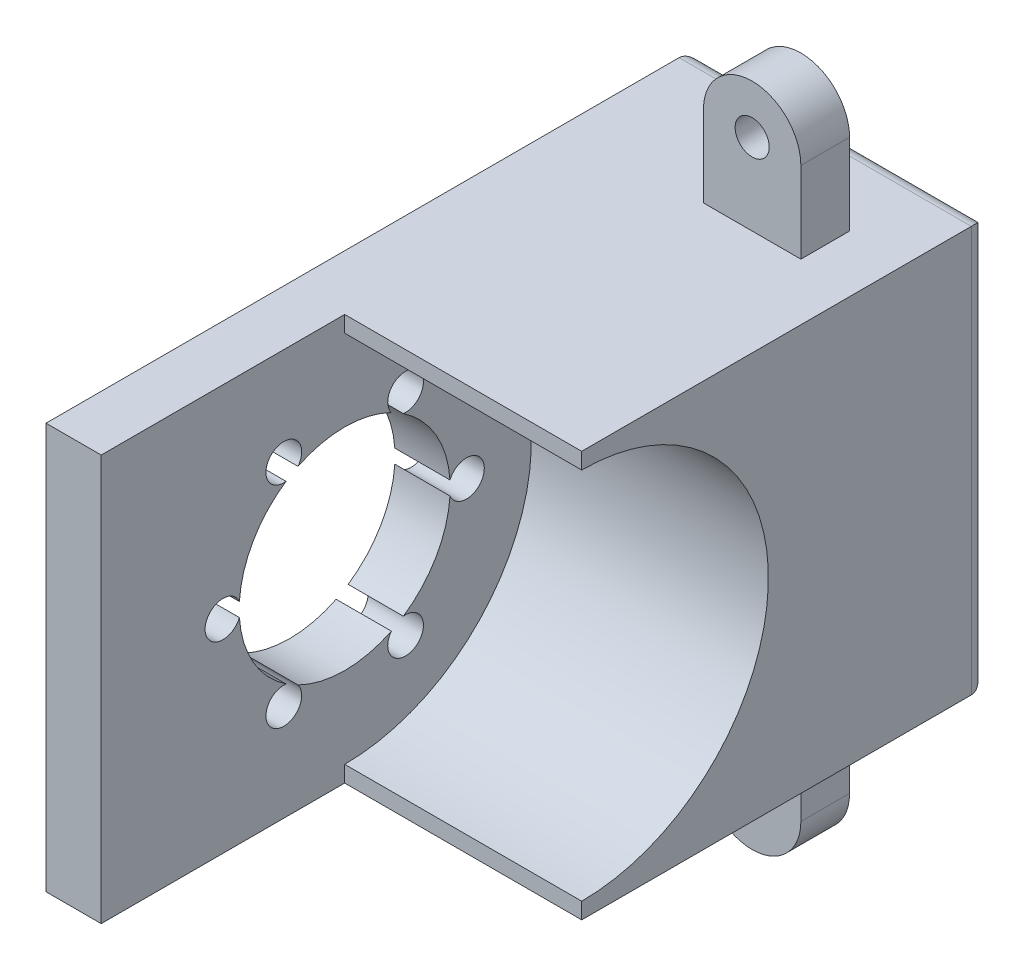
from build123d import *

# Parameters (mm, degrees)
SKETCH_1_W          = 23
SKETCH_1_H          = 25
EXTRUDE_1_DEPTH     = 25
SKETCH_2_W          = 19.6
SKETCH_2_H          = 11.5
SKETCH_4_W          = 3.4
SKETCH_4_H          = 25
EXTRUDE_2_DEPTH     = 15
CUT_EXTRUDE_1_DEPTH = 4
SKETCH_8_R          = 1.05
EXTRUDE_3_DEPTH     = 8
SKETCH_8_2_R        = 1.05
CUT_EXTRUDE_4_DEPTH = 5
SKETCH_7_W          = 35
SKETCH_7_H          = 40
CUT_EXTRUDE_3_DEPTH = 5
FILLET_1_R          = 1


with BuildPart() as part:
    # 草图1 → 凸台-拉伸1 (new body)
    with BuildSketch(Plane.XY):
        Rectangle(SKETCH_1_W, SKETCH_1_H)
    extrude(amount=-EXTRUDE_1_DEPTH)

    # 草图2 → 切除-旋转2 (revolve, cut)
    with BuildSketch(Plane.XY):
        with Locations((1.7, -5.75)):
            Rectangle(SKETCH_2_W, SKETCH_2_H)
    revolve(axis=Axis((11.5, 0, 0), (-1, 0, 0)), mode=Mode.SUBTRACT)

    # 草图4 → 凸台-拉伸2 (add)
    with BuildSketch(Plane.XY):
        with Locations((-9.8, 0)):
            Rectangle(SKETCH_4_W, SKETCH_4_H)
    extrude(amount=EXTRUDE_2_DEPTH)

    # 草图6 → 切除-拉伸1 (cut)
    with BuildSketch(Plane(origin=(-8.1, 0, 0), x_dir=(0, 0, -1), z_dir=(1, 0, 0))):
        with BuildLine():
            ThreePointArc((6.486, -0.426384803), (8.6, 0), (6.486, 0.426384803))
            ThreePointArc((6.486, 0.426384803), (5.629165125, 3.25), (3.612260071, 5.403848368))
            ThreePointArc((3.612260071, 5.403848368), (4.3, 7.447818473), (2.873739929, 5.83023317))
            ThreePointArc((2.873739929, 5.83023317), (0, 6.5), (-2.873739929, 5.83023317))
            ThreePointArc((-2.873739929, 5.83023317), (-4.3, 7.447818473), (-3.612260071, 5.403848368))
            ThreePointArc((-3.612260071, 5.403848368), (-5.629165125, 3.25), (-6.486, 0.426384803))
            ThreePointArc((-6.486, 0.426384803), (-8.6, 0), (-6.486, -0.426384803))
            ThreePointArc((-6.486, -0.426384803), (-5.629165125, -3.25), (-3.612260071, -5.403848368))
            ThreePointArc((-3.612260071, -5.403848368), (-4.3, -7.447818473), (-2.873739929, -5.83023317))
            ThreePointArc((-2.873739929, -5.83023317), (0, -6.5), (2.873739929, -5.83023317))
            ThreePointArc((2.873739929, -5.83023317), (4.3, -7.447818473), (3.612260071, -5.403848368))
            ThreePointArc((3.612260071, -5.403848368), (5.629165125, -3.25), (6.486, -0.426384803))
        make_face()
    extrude(amount=-CUT_EXTRUDE_1_DEPTH, mode=Mode.SUBTRACT)

    # 草图8 → 凸台-拉伸3 (add)
    # profile 1 of 2: a face of its own
    with BuildSketch(Plane(origin=(0, 0, -25), x_dir=(-1, 0, 0), z_dir=(0, 0, -1))):
        with BuildLine():
            Line((3, 17.5), (3, 12.5))
            Line((3, 12.5), (-3, 12.5))
            Line((-3, 12.5), (-3, 17.5))
            ThreePointArc((-3, 17.5), (0, 20.5), (3, 17.5))
        make_face()
        with Locations((0, 17.5)):
            Circle(SKETCH_8_R, mode=Mode.SUBTRACT)
    # profile 2 of 2: a face of its own
    with BuildSketch(Plane(origin=(0, 0, -25), x_dir=(-1, 0, 0), z_dir=(0, 0, -1))):
        with BuildLine():
            Line((-3, -17.5), (-3, -12.5))
            Line((-3, -12.5), (3, -12.5))
            Line((3, -12.5), (3, -17.5))
            ThreePointArc((3, -17.5), (0, -20.5), (-3, -17.5))
        make_face()
        with Locations((0, -17.5)):
            Circle(SKETCH_8_R, mode=Mode.SUBTRACT)
    extrude(amount=-EXTRUDE_3_DEPTH)

    # 草图8<2> → 切除-拉伸4 (cut)
    # profile 1 of 2: a face of its own
    with BuildSketch(Plane(origin=(0, 0, -25), x_dir=(-1, 0, 0), z_dir=(0, 0, -1))):
        with BuildLine():
            Line((3, 17.5), (3, 12.5))
            Line((3, 12.5), (-3, 12.5))
            Line((-3, 12.5), (-3, 17.5))
            ThreePointArc((-3, 17.5), (0, 20.5), (3, 17.5))
        make_face()
        with Locations((0, 17.5)):
            Circle(SKETCH_8_2_R, mode=Mode.SUBTRACT)
    # profile 2 of 2: a face of its own
    with BuildSketch(Plane(origin=(0, 0, -25), x_dir=(-1, 0, 0), z_dir=(0, 0, -1))):
        with BuildLine():
            Line((-3, -17.5), (-3, -12.5))
            Line((-3, -12.5), (3, -12.5))
            Line((3, -12.5), (3, -17.5))
            ThreePointArc((3, -17.5), (0, -20.5), (-3, -17.5))
        make_face()
        with Locations((0, -17.5)):
            Circle(SKETCH_8_2_R, mode=Mode.SUBTRACT)
    extrude(amount=-CUT_EXTRUDE_4_DEPTH, mode=Mode.SUBTRACT)

    # 草图7 → 切除-拉伸3 (cut)
    with BuildSketch(Plane(origin=(11.5, 0, 0), x_dir=(0, 0, -1), z_dir=(1, 0, 0))):
        with Locations((11.5, 0)):
            Rectangle(SKETCH_7_W, SKETCH_7_H)
    extrude(amount=-CUT_EXTRUDE_3_DEPTH, mode=Mode.SUBTRACT)

    # 圆角1
    fillet_1_edges = [part.edges().sort_by_distance(p)[0] for p in [
        (-2.5, -12.5, -25),
        (-11.5, 0, -25),
        (-2.5, 12.5, -25),
        (6.5, 0, -25),
    ]]
    fillet(fillet_1_edges, radius=FILLET_1_R)


solid = part.part
